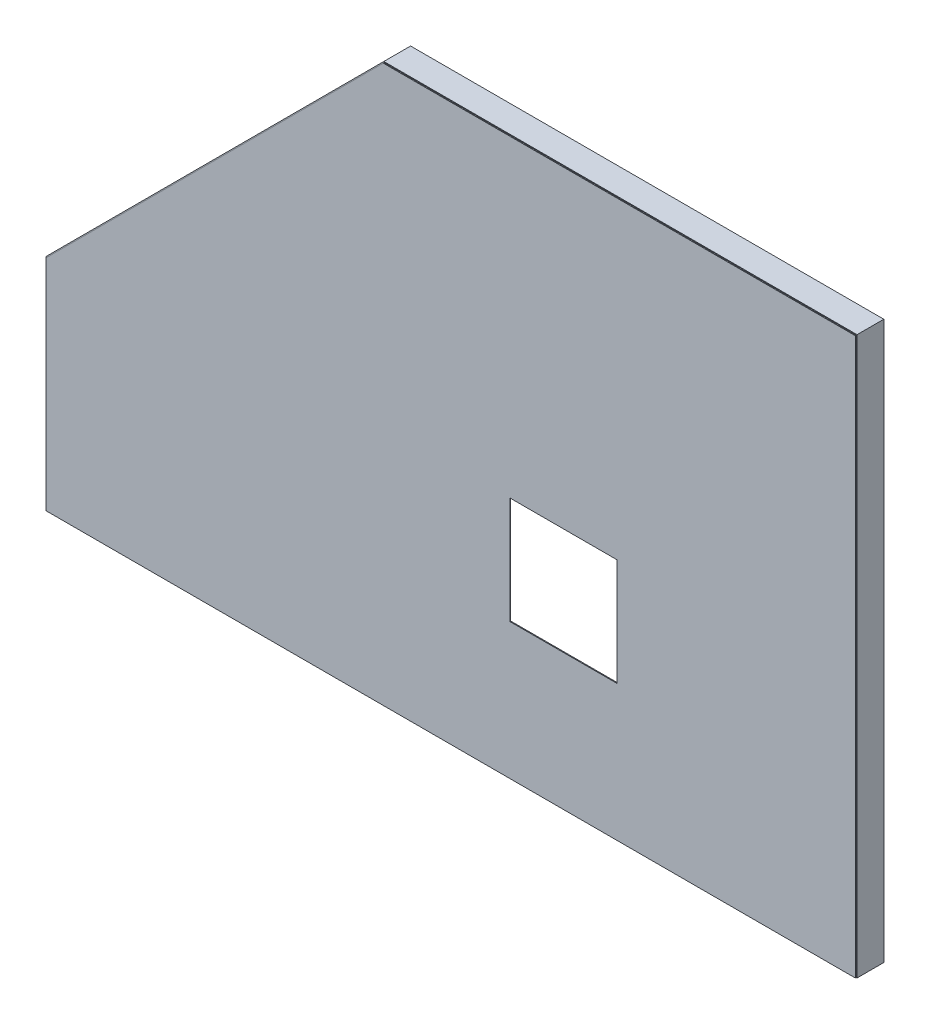
from build123d import *

# Parameters (mm, degrees)
SALIENTE_EXTRUIR1_DEPTH = 0.83566
CROQUIS2_W              = 101.6
CROQUIS2_H              = 101.6
CORTAR_EXTRUIR1_DEPTH   = 454.83566
SALIENTE_EXTRUIR2_DEPTH = 25.4


with BuildPart() as part:
    # Croquis1 → Saliente-Extruir1 (new body)
    with BuildSketch(Plane.XY):
        Polygon((0, 0), (768, 0), (768, 528), (320, 528), (0, 208), align=None)
    extrude(amount=SALIENTE_EXTRUIR1_DEPTH)

    # Croquis2 → Cortar-Extruir1 (cut)
    with BuildSketch(Plane.XY.offset(0.83566)):
        with Locations((490.839276622, 179.877007982)):
            Rectangle(CROQUIS2_W, CROQUIS2_H)
    extrude(amount=-CORTAR_EXTRUIR1_DEPTH, mode=Mode.SUBTRACT)


with BuildPart() as body_2:
    # Croquis3 → Saliente-Extruir2 (new body)
    with BuildSketch(Plane(origin=(0, 0, 0), x_dir=(-1, 0, 0), z_dir=(0, 0, -1))):
        Polygon((0.83566, 0), (0.83566, 208.346141706), (-319.653858294, 528.83566), (-768.83566, 528.83566), (-768.83566, 0), (-768, 0), (-768, 528), (-320, 528), (0, 208), (0, 0), align=None)
    extrude(amount=SALIENTE_EXTRUIR2_DEPTH)


solid = Compound([part.part, body_2.part])
